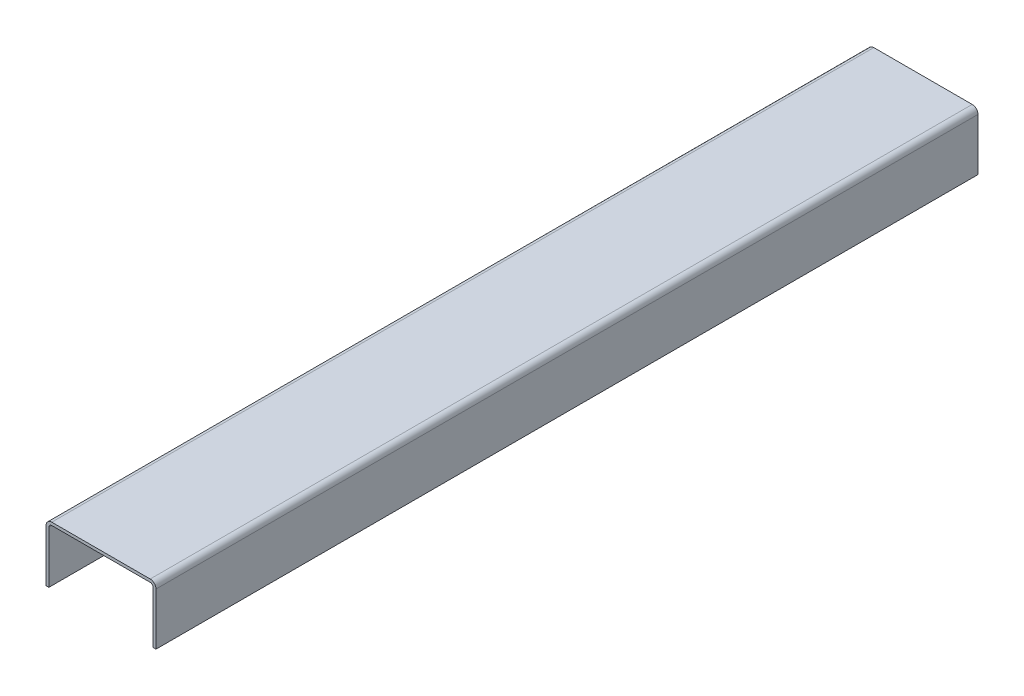
from build123d import *

# Parameters (mm, degrees)
BOSS_EXTRUDE1_DEPTH = 284


with BuildPart() as part:
    # Sketch1 → Boss-Extrude1 (new body)
    with BuildSketch(Plane.XY):
        with BuildLine():
            Line((0, 0), (0, 18))
            ThreePointArc((0, 18), (0.585786438, 19.414213562), (2, 20))
            Line((2, 20), (36, 20))
            ThreePointArc((36, 20), (37.414213562, 19.414213562), (38, 18))
            Line((38, 18), (38, 0))
            Line((38, 0), (37, 0))
            Line((37, 0), (37, 18))
            ThreePointArc((37, 18), (36.707106781, 18.707106781), (36, 19))
            Line((36, 19), (2, 19))
            ThreePointArc((2, 19), (1.292893219, 18.707106781), (1, 18))
            Line((1, 18), (1, 0))
            Line((1, 0), (0, 0))
        make_face()
    extrude(amount=BOSS_EXTRUDE1_DEPTH)


solid = part.part
